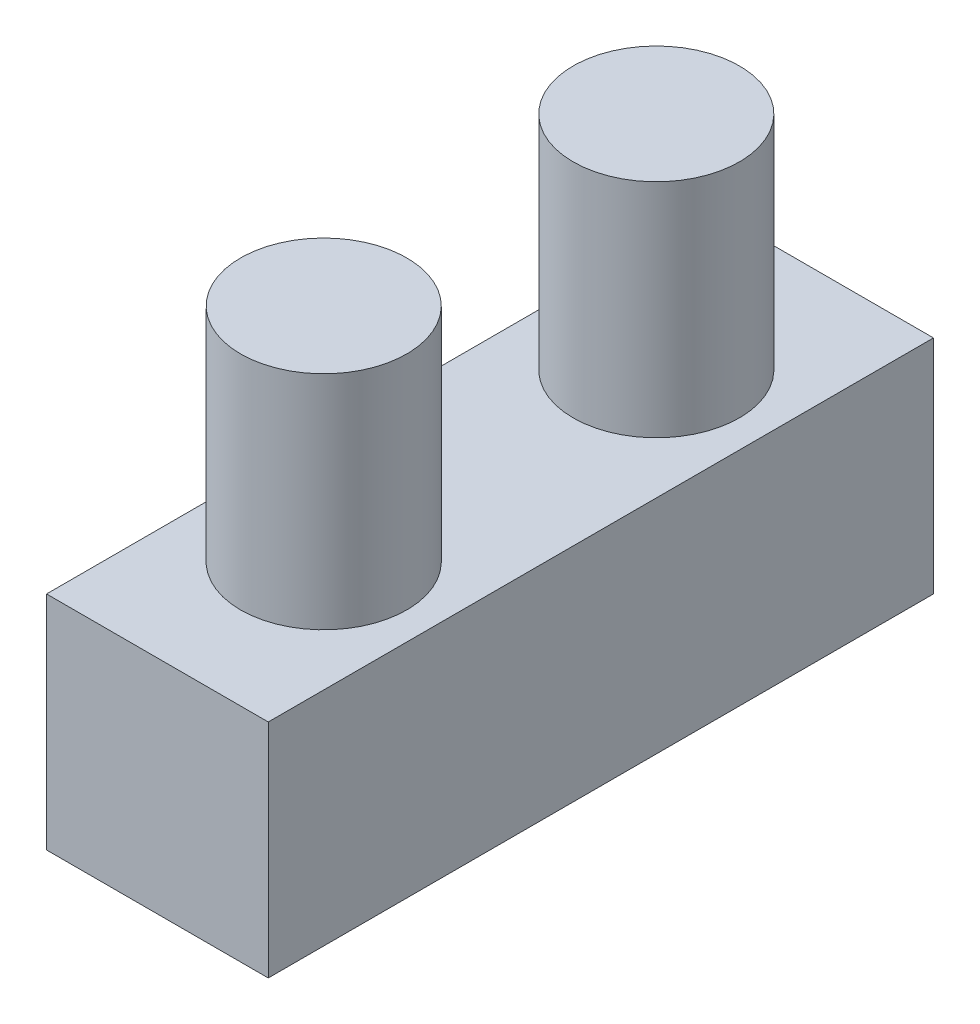
from build123d import *

# Parameters (mm, degrees)
SKETCH1_W           = 2
SKETCH1_H           = 6
BOSS_EXTRUDE1_DEPTH = 2
SKETCH2_R           = 0.75
BOSS_EXTRUDE2_DEPTH = 2


with BuildPart() as part:
    # Sketch1 → Boss-Extrude1 (new body)
    with BuildSketch(Plane(origin=(0, 0, 0), x_dir=(1, 0, 0), z_dir=(0, 1, 0))):
        with Locations((1, -3)):
            Rectangle(SKETCH1_W, SKETCH1_H)
    extrude(amount=BOSS_EXTRUDE1_DEPTH)

    # Sketch2 → Boss-Extrude2 (add)
    with BuildSketch(Plane(origin=(0, 2, 0), x_dir=(1, 0, 0), z_dir=(0, 1, 0))):
        with Locations(Location((1, -1.5, 0), (0, 0, 270))):
            Circle(SKETCH2_R)
        with Locations(Location((1, -4.5, 0), (0, 0, 270))):
            Circle(SKETCH2_R)
    extrude(amount=BOSS_EXTRUDE2_DEPTH)


solid = part.part
